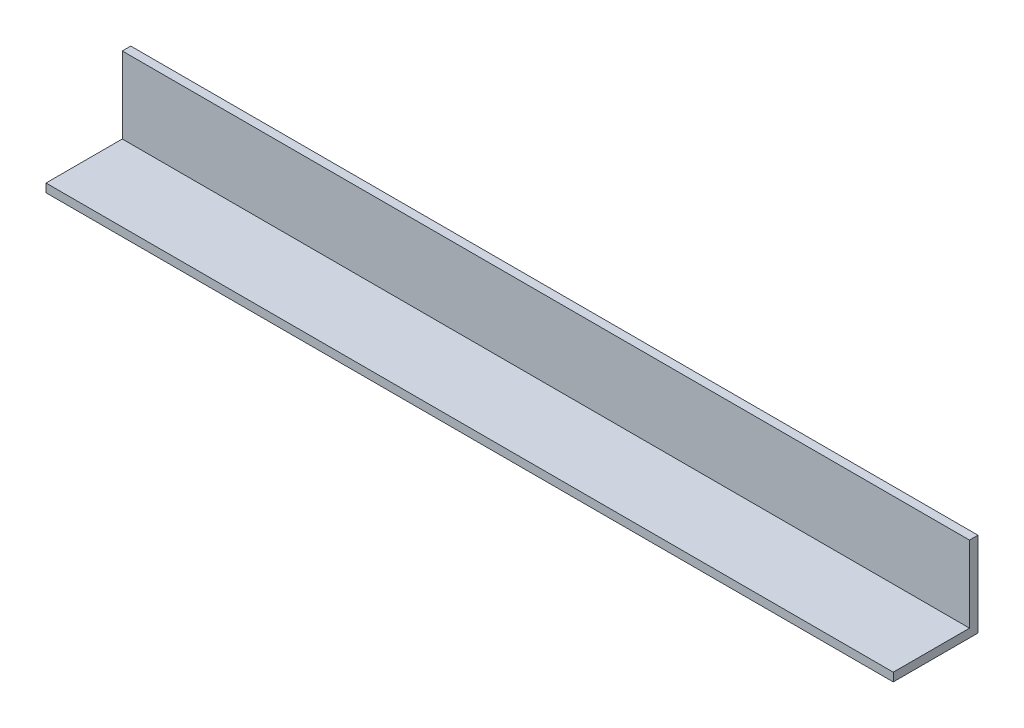
from build123d import *

# Parameters (mm, degrees)
SALIENTE_EXTRUIR1_DEPTH = 150


with BuildPart() as part:
    # Croquis1 → Saliente-Extruir1 (new body)
    with BuildSketch(Plane(origin=(0, 0, 0), x_dir=(0, 0, -1), z_dir=(1, 0, 0))):
        Polygon((0, 0), (-15, 0), (-15, 1.5), (-1.5, 1.5), (-1.5, 15), (0, 15), align=None)
    extrude(amount=SALIENTE_EXTRUIR1_DEPTH)


solid = part.part
